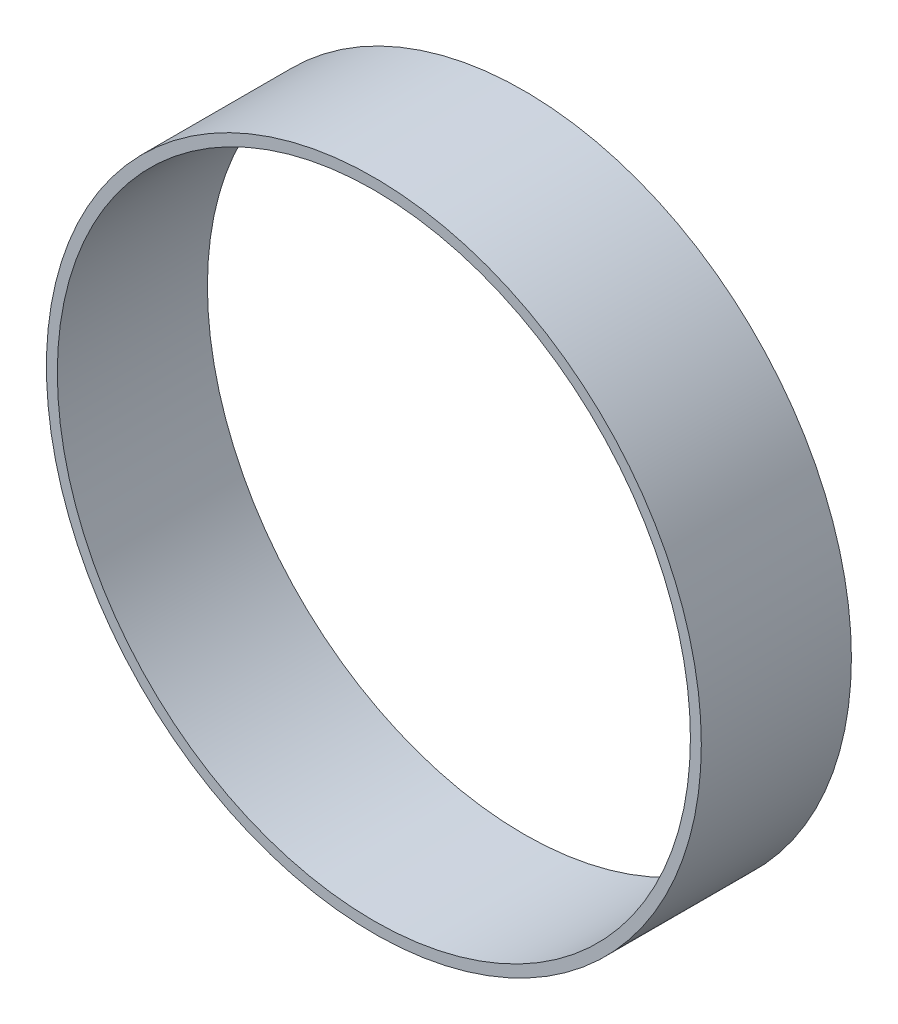
from build123d import *

# Parameters (mm, degrees)
SKETCH1_R           = 76.2
SKETCH1_R_2         = 73.66
BOSS_EXTRUDE1_DEPTH = 34.925


with BuildPart() as part:
    # Sketch1 → Boss-Extrude1 (new body)
    with BuildSketch(Plane.XY):
        Circle(SKETCH1_R)
        Circle(SKETCH1_R_2, mode=Mode.SUBTRACT)
    extrude(amount=BOSS_EXTRUDE1_DEPTH)


solid = part.part
